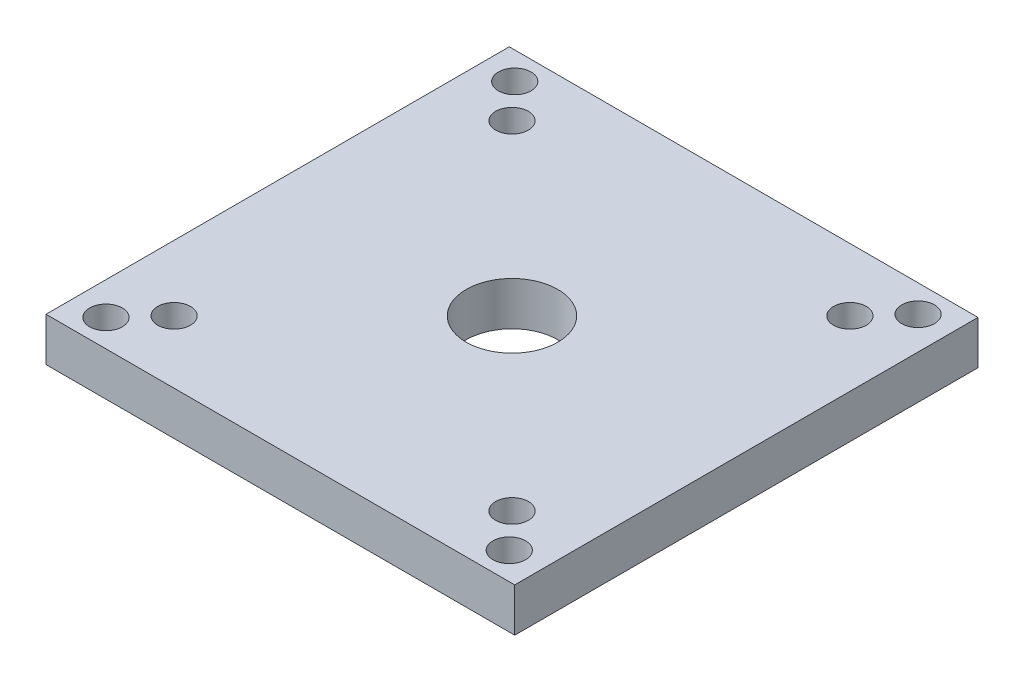
from build123d import *

# Parameters (mm, degrees)
SKETCH_1_W          = 43
SKETCH_1_H          = 42.5
EXTRUDE_1_DEPTH     = 4
SKETCH_2_R          = 1.5
CUT_EXTRUDE_1_DEPTH = 10
SKETCH_3_R          = 1.5
CUT_EXTRUDE_2_DEPTH = 10
SKETCH_4_R          = 4.2
CUT_EXTRUDE_3_DEPTH = 4


with BuildPart() as part:
    # Эскиз1 → Бобышка-Вытянуть1 (new body)
    with BuildSketch(Plane(origin=(0, 0, 0), x_dir=(1, 0, 0), z_dir=(0, 1, 0))):
        with Locations((-15.064488683, 7.723245358)):
            Rectangle(SKETCH_1_W, SKETCH_1_H)
    extrude(amount=EXTRUDE_1_DEPTH)

    # Эскиз2 → Вырез-Вытянуть1 (cut)
    with BuildSketch(Plane.XZ):
        with Locations(Location((-33.564488683, 11.026754642, 0), (0, 0, 270))):
            Circle(SKETCH_2_R)
        with Locations(Location((3.435511317, 11.026754642, 0), (0, 0, 270))):
            Circle(SKETCH_2_R)
        with Locations(Location((-33.564488683, -26.473245358, 0), (0, 0, 270))):
            Circle(SKETCH_2_R)
        with Locations(Location((3.435511317, -26.473245358, 0), (0, 0, 270))):
            Circle(SKETCH_2_R)
    extrude(amount=-CUT_EXTRUDE_1_DEPTH, mode=Mode.SUBTRACT)

    # Эскиз3 → Вырез-Вытянуть2 (cut)
    with BuildSketch(Plane.XZ):
        with Locations(Location((-30.564488683, 7.776754642, 0), (0, 0, 270))):
            Circle(SKETCH_3_R)
        with Locations(Location((-30.564488683, -23.223245358, 0), (0, 0, 270))):
            Circle(SKETCH_3_R)
        with Locations(Location((0.435511317, 7.776754642, 0), (0, 0, 270))):
            Circle(SKETCH_3_R)
        with Locations(Location((0.435511317, -23.223245358, 0), (0, 0, 270))):
            Circle(SKETCH_3_R)
    extrude(amount=-CUT_EXTRUDE_2_DEPTH, mode=Mode.SUBTRACT)

    # Эскиз4 → Вырез-Вытянуть3 (cut)
    with BuildSketch(Plane(origin=(0, 4, 0), x_dir=(1, 0, 0), z_dir=(0, 1, 0))):
        with Locations(Location((-15.064488683, 7.723245358, 0), (0, 0, 270))):
            Circle(SKETCH_4_R)
    extrude(amount=-CUT_EXTRUDE_3_DEPTH, mode=Mode.SUBTRACT)


solid = part.part
